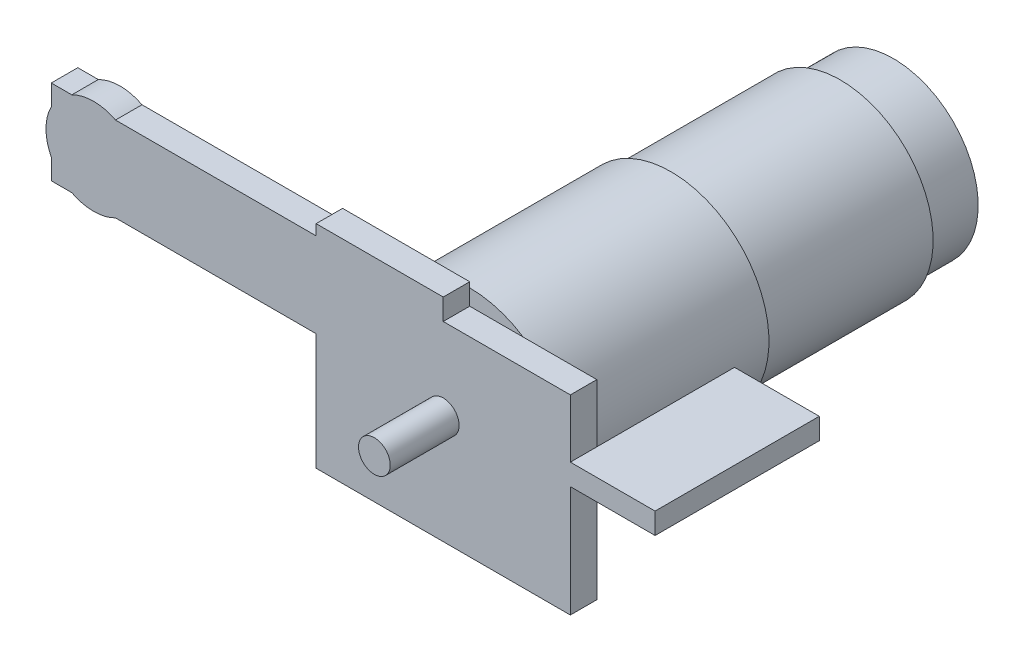
from build123d import *

# Parameters (mm, degrees)
SK_P02_MODULEPLATE_W  = 24
SK_P02_MODULEPLATE_H  = 5
P02_MODULEPLATE_DEPTH = 40
SK_P03_MODULEPLATE_W  = 24
SK_P03_MODULEPLATE_H  = 5
P03_MODULEPLATE_DEPTH = 36
P04_TRAILINGARM_START = 22
SK_P04_TRAILINGARM_W  = 50
SK_P04_TRAILINGARM_H  = 5
P04_TRAILINGARM_DEPTH = 16
P05_PIVOTBOSS_START   = 31
SK_P05_PIVOTBOSS_R    = 9
P05_PIVOTBOSS_DEPTH   = 5
P06_SPRINGTAB_START   = 21
SK_P06_SPRINGTAB_W    = 16
SK_P06_SPRINGTAB_H    = 31
P06_SPRINGTAB_DEPTH   = 4


with BuildPart() as part:
    # SK_P01_Gearmotor37Dwith64CPRenc → P01_Gearmotor37Dwith64CPRenc (revolve)
    with BuildSketch(Plane(origin=(0, 20.5, 0), x_dir=(1, 0, 0), z_dir=(0, 1, 0)), mode=Mode.PRIVATE) as p01_gearmotor37dwith64cprenc_sk:
        Polygon((17.5, -49), (20.5, -49), (20.5, -31), (36, -31), (36, 7), (35, 7), (35, 39), (33.5, 39), (33.5, 49), (17.5, 49), align=None)
    revolve(p01_gearmotor37dwith64cprenc_sk.sketch.rotate(Axis((17.5, 20.5, -54), (0, 0, 1)), 180), axis=Axis((17.5, 20.5, -54), (0, 0, 1)))

    # SK_P02_Moduleplate → P02_Moduleplate (add)
    with BuildSketch(Plane(origin=(0, 0, 0), x_dir=(1, 0, 0), z_dir=(0, 1, 0))):
        with Locations((5.5, -33.5)):
            Rectangle(SK_P02_MODULEPLATE_W, SK_P02_MODULEPLATE_H)
    extrude(amount=P02_MODULEPLATE_DEPTH)

    # SK_P03_Moduleplate → P03_Moduleplate (add)
    with BuildSketch(Plane(origin=(0, 0, 0), x_dir=(1, 0, 0), z_dir=(0, 1, 0))):
        with Locations((29.5, -33.5)):
            Rectangle(SK_P03_MODULEPLATE_W, SK_P03_MODULEPLATE_H)
    extrude(amount=P03_MODULEPLATE_DEPTH)

    # SK_P04_Trailingarm → P04_Trailingarm (add)
    with BuildSketch(Plane(origin=(0, 0, 0), x_dir=(1, 0, 0), z_dir=(0, 1, 0)).offset(P04_TRAILINGARM_START)):
        with Locations((-31.5, -33.5)):
            Rectangle(SK_P04_TRAILINGARM_W, SK_P04_TRAILINGARM_H)
    extrude(amount=P04_TRAILINGARM_DEPTH)

    # SK_P05_Pivotboss → P05_Pivotboss (add)
    with BuildSketch(Plane.XY.offset(P05_PIVOTBOSS_START)):
        with Locations((-48.5, 30)):
            Circle(SK_P05_PIVOTBOSS_R)
    extrude(amount=P05_PIVOTBOSS_DEPTH)

    # SK_P06_Springtab → P06_Springtab (add)
    with BuildSketch(Plane(origin=(0, 0, 0), x_dir=(1, 0, 0), z_dir=(0, 1, 0)).offset(P06_SPRINGTAB_START)):
        with Locations((49.5, -20.5)):
            Rectangle(SK_P06_SPRINGTAB_W, SK_P06_SPRINGTAB_H)
    extrude(amount=P06_SPRINGTAB_DEPTH)


solid = part.part
